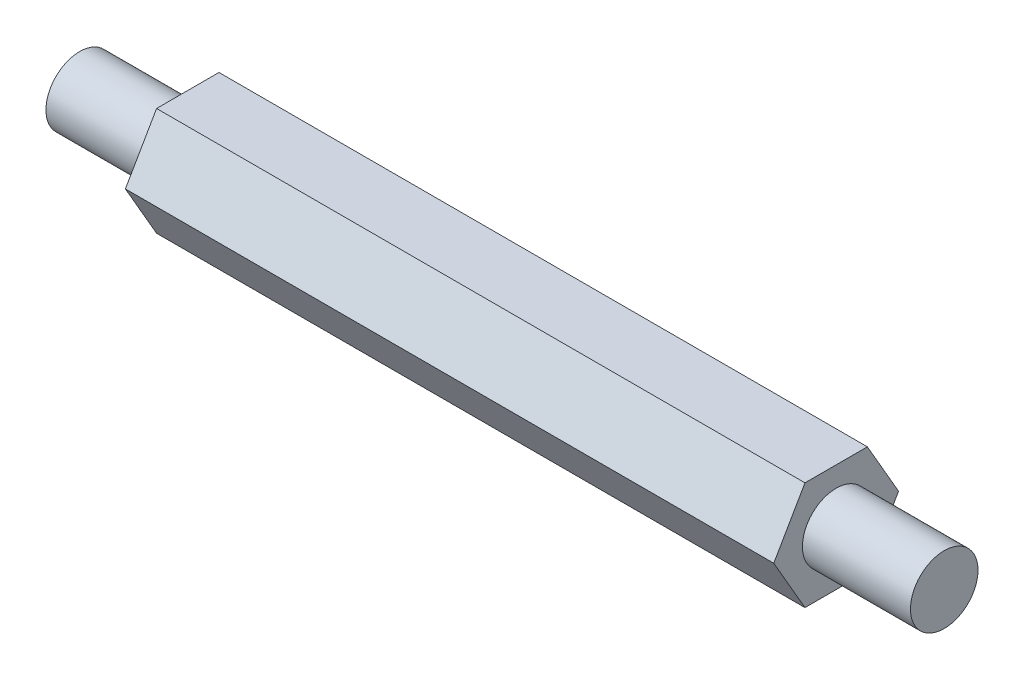
from build123d import *

# Parameters (mm, degrees)
BOSS_EXTRUDE1_DEPTH = 203.2
SKETCH2_OUTSIDE_W   = 72.704
SKETCH2_OUTSIDE_H   = 68.774
SKETCH2_OUTSIDE_R   = 7.9375
CUT_EXTRUDE1_DEPTH  = 25.4
CUT_EXTRUDE3_START  = -177.8
SKETCH2_2_OUTSIDE_W = 72.704
SKETCH2_2_OUTSIDE_H = 68.774
SKETCH2_2_OUTSIDE_R = 7.9375
CUT_EXTRUDE3_DEPTH  = 25.4


with BuildPart() as part:
    # Sketch1 → Boss-Extrude1 (new body)
    with BuildSketch(Plane(origin=(0, 0, 0), x_dir=(0, 0, -1), z_dir=(1, 0, 0))):
        Polygon((14.664696837, 0), (7.332348419, 12.7), (-7.332348419, 12.7), (-14.664696837, 0), (-7.332348419, -12.7), (7.332348419, -12.7), align=None)
    extrude(amount=BOSS_EXTRUDE1_DEPTH)

    # Sketch2 outside → Cut-Extrude1 (cut)
    with BuildSketch(Plane(origin=(203.2, 0, 0), x_dir=(0, 0, -1), z_dir=(1, 0, 0))):
        Rectangle(SKETCH2_OUTSIDE_W, SKETCH2_OUTSIDE_H)
        Circle(SKETCH2_OUTSIDE_R, mode=Mode.SUBTRACT)
    extrude(amount=-CUT_EXTRUDE1_DEPTH, mode=Mode.SUBTRACT)

    # Sketch2<2> outside → Cut-Extrude3 (cut)
    with BuildSketch(Plane(origin=(203.2, 0, 0), x_dir=(0, 0, -1), z_dir=(1, 0, 0)).offset(CUT_EXTRUDE3_START)):
        Rectangle(SKETCH2_2_OUTSIDE_W, SKETCH2_2_OUTSIDE_H)
        Circle(SKETCH2_2_OUTSIDE_R, mode=Mode.SUBTRACT)
    extrude(amount=-CUT_EXTRUDE3_DEPTH, mode=Mode.SUBTRACT)


solid = part.part
